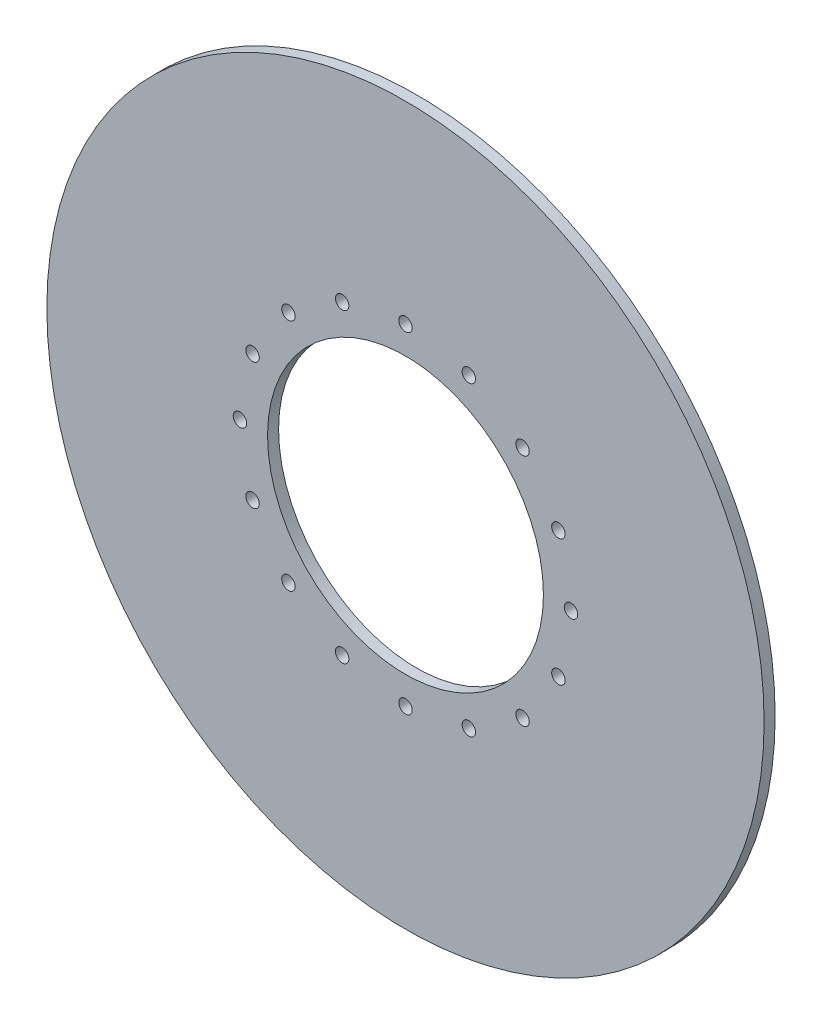
from build123d import *

# Parameters (mm, degrees)
SKETCH1_R           = 325
SKETCH1_R_2         = 125
SKETCH1_R_3         = 6.1
BOSS_EXTRUDE1_DEPTH = 10


with BuildPart() as part:
    # Sketch1 → Boss-Extrude1 (new body)
    with BuildSketch(Plane.XY):
        Circle(SKETCH1_R)
        Circle(SKETCH1_R_2, mode=Mode.SUBTRACT)
        with Locations((0, 150)):
            Circle(SKETCH1_R_3, mode=Mode.SUBTRACT)
        with Locations((57.402514855, 138.581929877)):
            Circle(SKETCH1_R_3, mode=Mode.SUBTRACT)
        with Locations((106.066017178, 106.066017178)):
            Circle(SKETCH1_R_3, mode=Mode.SUBTRACT)
        with Locations((138.581929877, 57.402514855)):
            Circle(SKETCH1_R_3, mode=Mode.SUBTRACT)
        with Locations((150, 0)):
            Circle(SKETCH1_R_3, mode=Mode.SUBTRACT)
        with Locations((138.581929877, -57.402514855)):
            Circle(SKETCH1_R_3, mode=Mode.SUBTRACT)
        with Locations((106.066017178, -106.066017178)):
            Circle(SKETCH1_R_3, mode=Mode.SUBTRACT)
        with Locations((57.402514855, -138.581929877)):
            Circle(SKETCH1_R_3, mode=Mode.SUBTRACT)
        with Locations((0, -150)):
            Circle(SKETCH1_R_3, mode=Mode.SUBTRACT)
        with Locations((-57.402514855, -138.581929877)):
            Circle(SKETCH1_R_3, mode=Mode.SUBTRACT)
        with Locations((-106.066017178, -106.066017178)):
            Circle(SKETCH1_R_3, mode=Mode.SUBTRACT)
        with Locations((-138.581929877, -57.402514855)):
            Circle(SKETCH1_R_3, mode=Mode.SUBTRACT)
        with Locations((-150, 0)):
            Circle(SKETCH1_R_3, mode=Mode.SUBTRACT)
        with Locations((-138.581929877, 57.402514855)):
            Circle(SKETCH1_R_3, mode=Mode.SUBTRACT)
        with Locations((-106.066017178, 106.066017178)):
            Circle(SKETCH1_R_3, mode=Mode.SUBTRACT)
        with Locations((-57.402514855, 138.581929877)):
            Circle(SKETCH1_R_3, mode=Mode.SUBTRACT)
    extrude(amount=BOSS_EXTRUDE1_DEPTH)


solid = part.part
